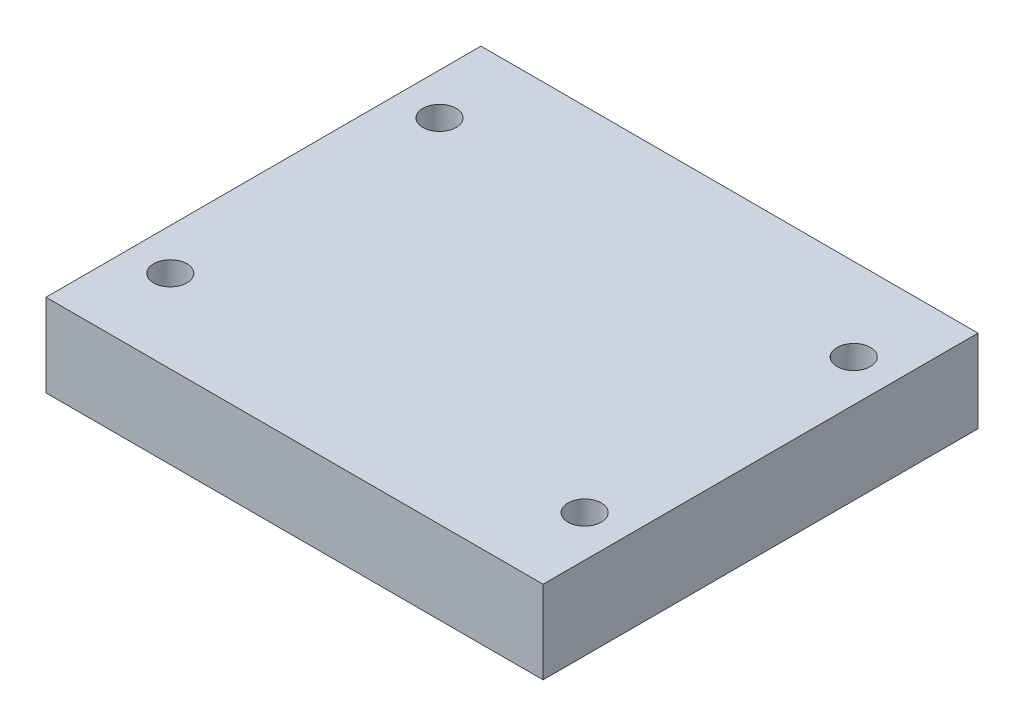
from build123d import *

# Parameters (mm, degrees)
SKETCH1_W              = 76.2
SKETCH1_H              = 66.675
BOSS_EXTRUDE1_DEPTH    = 12.7
F_10_CLEARANCE_HOLE1_D = 5.1054


with BuildPart() as part:
    # Sketch1 → Boss-Extrude1 (new body)
    with BuildSketch(Plane(origin=(0, 0, 0), x_dir=(1, 0, 0), z_dir=(0, 1, 0))):
        Rectangle(SKETCH1_W, SKETCH1_H)
    extrude(amount=BOSS_EXTRUDE1_DEPTH)

    # #10 Clearance Hole1 (through all)
    with Locations(Plane(origin=(0, 12.7, 0), x_dir=(1, 0, 0), z_dir=(0, 1, 0))):
        with Locations((-31.75, 20.6375), (-31.75, -20.6375), (31.75, 20.6375), (31.774810746, -20.6375)):
            Hole(F_10_CLEARANCE_HOLE1_D / 2)


solid = part.part
